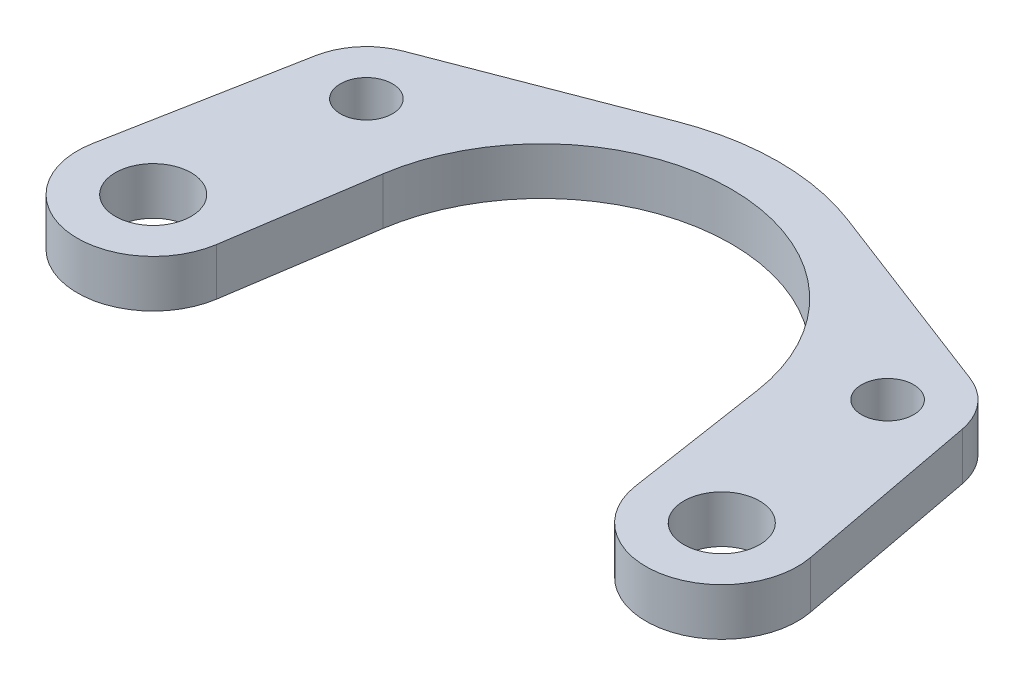
from build123d import *

# Parameters (mm, degrees)
SKETCH1_R           = 5.08
SKETCH1_R_2         = 3.4925
BOSS_EXTRUDE1_DEPTH = 6.35


with BuildPart() as part:
    # Sketch1 → Boss-Extrude1 (new body)
    with BuildSketch(Plane(origin=(0, 0, 0), x_dir=(1, 0, 0), z_dir=(0, 1, 0))):
        with BuildLine():
            Line((48.08398312, -12.08700211), (43.348985758, 13.01877947))
            ThreePointArc((43.348985758, 13.01877947), (41.506349611, 16.923049567), (37.994491732, 19.434122485))
            Line((37.994491732, 19.434122485), (11.368487897, 29.644898093))
            ThreePointArc((11.368487897, 29.644898093), (0, 31.75), (-11.368487897, 29.644898093))
            Line((-11.368487897, 29.644898093), (-37.994491732, 19.434122485))
            ThreePointArc((-37.994491732, 19.434122485), (-41.506349611, 16.923049567), (-43.348985758, 13.01877947))
            Line((-43.348985758, 13.01877947), (-48.08398312, -12.08700211))
            ThreePointArc((-48.08398312, -12.08700211), (-39.807216346, -23.985538545), (-28.056000656, -15.500907303))
            Line((-28.056000656, -15.500907303), (-25.109998361, 3.827268257))
            ThreePointArc((-25.109998361, 3.827268257), (0, 25.4), (25.109998361, 3.827268257))
            Line((25.109998361, 3.827268257), (28.056000656, -15.500907303))
            ThreePointArc((28.056000656, -15.500907303), (39.807216346, -23.985538545), (48.08398312, -12.08700211))
        make_face()
        with Locations(Location((38.1, -13.97, 0), (0, 0, 270))):
            Circle(SKETCH1_R, mode=Mode.SUBTRACT)
        with Locations(Location((34.925, 11.43, 0), (0, 0, 270))):
            Circle(SKETCH1_R_2, mode=Mode.SUBTRACT)
        with Locations(Location((-34.925, 11.43, 0), (0, 0, 90))):
            Circle(SKETCH1_R_2, mode=Mode.SUBTRACT)
        with Locations(Location((-38.1, -13.97, 0), (0, 0, 90))):
            Circle(SKETCH1_R, mode=Mode.SUBTRACT)
    extrude(amount=BOSS_EXTRUDE1_DEPTH)


solid = part.part
